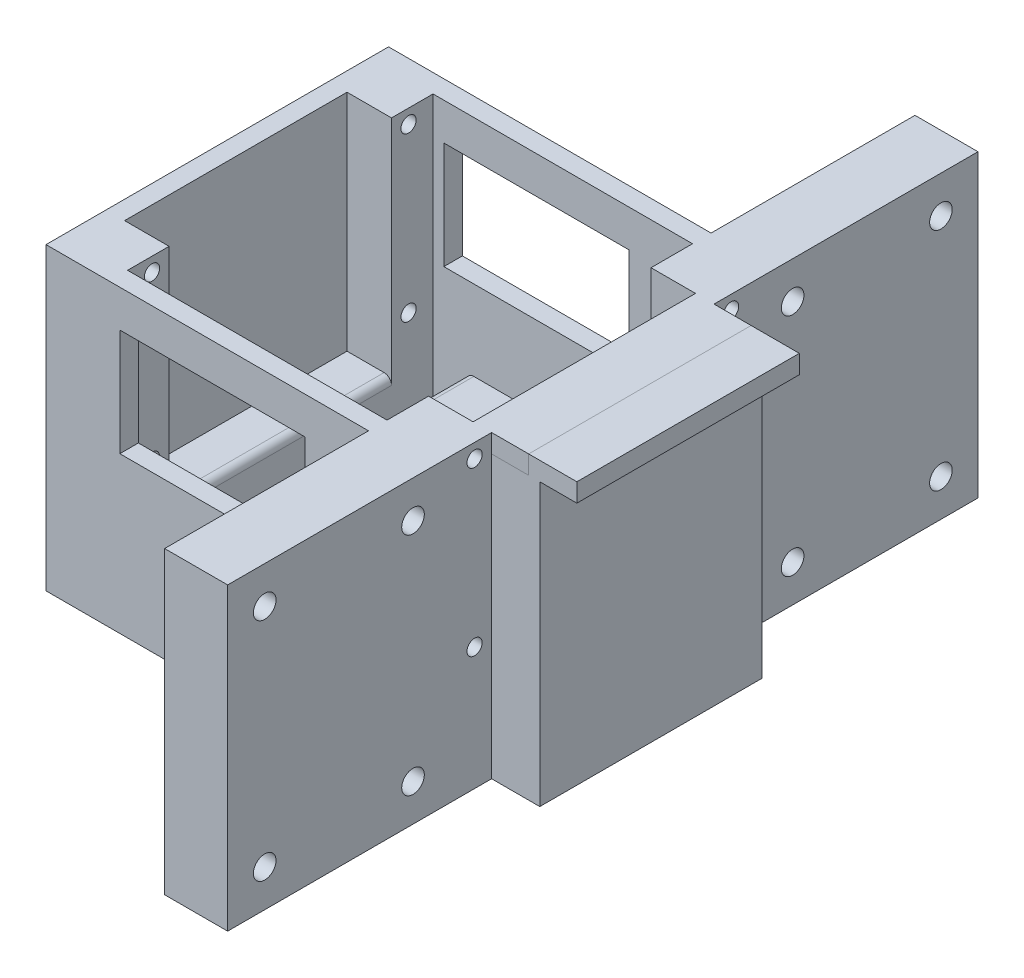
from build123d import *

# Parameters (mm, degrees)
BOSS_EXTRUDE1_DEPTH  = 30
SKETCH2_W            = 5.6
SKETCH2_H            = 40.443252471
SKETCH2_R            = 1.025
BOSS_EXTRUDE2_DEPTH  = 8.5
SKETCH4_W            = 25
SKETCH4_H            = 10.193252471
BOSS_EXTRUDE3_DEPTH  = 5.6
SKETCH5_W            = 25
SKETCH5_H            = 10.193252471
BOSS_EXTRUDE4_DEPTH  = 5.6
FILLET2_R            = 1
BOSS_EXTRUDE5_START  = -8.5
SKETCH6_W            = 5.6
SKETCH6_H            = 40.443252471
SKETCH6_R            = 1.025
BOSS_EXTRUDE5_DEPTH  = 8.5
FILLET3_R            = 1
SKETCH8_R            = 2.1
CUT_EXTRUDE1_DEPTH   = 8.5
SKETCH9_W            = 8.5
SKETCH9_H            = 30
BOSS_EXTRUDE6_DEPTH  = 40.443252471
SKETCH10_R           = 1.525
CUT_EXTRUDE2_DEPTH   = 191.623742611
SKETCH11_W           = 5
SKETCH11_H           = 30
BOSS_EXTRUDE7_DEPTH  = 2.5
SKETCH12_W           = 30
SKETCH12_H           = 37.943252471
BOSS_EXTRUDE8_DEPTH  = 5
SKETCH13_W           = 30
SKETCH13_H           = 40.443252471
BOSS_EXTRUDE9_DEPTH  = 1.5
SKETCH15_W           = 30
SKETCH15_H           = 2.5
BOSS_EXTRUDE10_DEPTH = 5
SKETCH17_W           = 2.5
SKETCH17_H           = 40.443252471
BOSS_EXTRUDE11_DEPTH = 43.500000004
SKETCH18_W           = 25
SKETCH18_H           = 14.443252471
CUT_EXTRUDE5_DEPTH   = 60
SKETCH19_W           = 43.500000004
SKETCH19_H           = 46.2
BOSS_EXTRUDE12_DEPTH = 4.593252471
SKETCH22_R           = 2.05
BOSS_EXTRUDE15_DEPTH = 9


with BuildPart() as part:
    # Sketch1 → Boss-Extrude1 (new body)
    with BuildSketch(Plane.XY):
        Polygon((-492.563683395, 133.170690652), (-492.563683395, 173.613943123), (-495.063683395, 173.613943123), (-495.063683395, 143.363943123), (-501.063683395, 143.363943123), (-501.063683395, 137.763943123), (-506.563683395, 137.763943123), (-506.563683395, 143.363943123), (-519.063683395, 143.363943123), (-531.563683395, 143.363943123), (-531.563683395, 137.763943123), (-536.063683395, 137.763943123), (-536.063683395, 143.363943123), (-542.063683399, 143.363943123), (-542.063683399, 173.613943123), (-544.563683399, 173.613943123), (-544.563683399, 133.170690652), align=None)
    extrude(amount=BOSS_EXTRUDE1_DEPTH)

    # Sketch2 → Boss-Extrude2 (add)
    # profile 1 of 2: a face of its own
    with BuildSketch(Plane.ZY.offset(544.563683399)):
        with Locations((-2.8, 153.392316888)):
            Rectangle(SKETCH2_W, SKETCH2_H)
        with Locations((-2.3, 171.713943123)):
            Circle(SKETCH2_R, mode=Mode.SUBTRACT)
        with Locations((-2.3, 149.713943123)):
            Circle(SKETCH2_R, mode=Mode.SUBTRACT)
    # profile 2 of 2: a face of its own
    with BuildSketch(Plane.ZY.offset(544.563683399)):
        with Locations((32.8, 153.392316888)):
            Rectangle(SKETCH2_W, SKETCH2_H)
        with Locations((32.3, 149.713943123)):
            Circle(SKETCH2_R, mode=Mode.SUBTRACT)
        with Locations((32.3, 171.713943123)):
            Circle(SKETCH2_R, mode=Mode.SUBTRACT)
    extrude(amount=-BOSS_EXTRUDE2_DEPTH)

    # Sketch4 → Boss-Extrude3 (add)
    with BuildSketch(Plane(origin=(0, 0, 0), x_dir=(-1, 0, 0), z_dir=(0, 0, -1))):
        with Locations((519.063683395, 138.267316888)):
            Rectangle(SKETCH4_W, SKETCH4_H)
    extrude(amount=BOSS_EXTRUDE3_DEPTH)

    # Sketch5 → Boss-Extrude4 (add)
    with BuildSketch(Plane.XY.offset(30)):
        with Locations((-519.063683395, 138.267316888)):
            Rectangle(SKETCH5_W, SKETCH5_H)
    extrude(amount=BOSS_EXTRUDE4_DEPTH)

    # Fillet2
    fillet2_edges = [part.edges().sort_by_distance(p)[0] for p in [
        (-531.563683395, 143.363943123, 15),
        (-506.563683395, 143.363943123, 15),
    ]]
    fillet(fillet2_edges, radius=FILLET2_R)

    # Sketch6 → Boss-Extrude5 (add)
    # profile 1 of 2: a face of its own
    with BuildSketch(Plane(origin=(-492.563683395, 0, 0), x_dir=(0, 0, -1), z_dir=(1, 0, 0)).offset(BOSS_EXTRUDE5_START)):
        with Locations((-32.8, 153.392316888)):
            Rectangle(SKETCH6_W, SKETCH6_H)
        with Locations(Location((-32.3, 171.713943123, 0), (0, 0, 180))):
            Circle(SKETCH6_R, mode=Mode.SUBTRACT)
        with Locations(Location((-32.3, 149.713943123, 0), (0, 0, 180))):
            Circle(SKETCH6_R, mode=Mode.SUBTRACT)
    # profile 2 of 2: a face of its own
    with BuildSketch(Plane(origin=(-492.563683395, 0, 0), x_dir=(0, 0, -1), z_dir=(1, 0, 0)).offset(BOSS_EXTRUDE5_START)):
        with Locations((2.8, 153.392316888)):
            Rectangle(SKETCH6_W, SKETCH6_H)
        with Locations(Location((2.3, 171.713943123, 0), (0, 0, 180))):
            Circle(SKETCH6_R, mode=Mode.SUBTRACT)
        with Locations(Location((2.3, 149.713943123, 0), (0, 0, 180))):
            Circle(SKETCH6_R, mode=Mode.SUBTRACT)
    extrude(amount=BOSS_EXTRUDE5_DEPTH)

    # Fillet3
    fillet3_edges = [part.edges().sort_by_distance(p)[0] for p in [
        (-536.063683395, 143.363943123, 15),
        (-501.063683395, 143.363943123, 15),
    ]]
    fillet(fillet3_edges, radius=FILLET3_R)

    # Sketch8 → Cut-Extrude1 (cut)
    with BuildSketch(Plane(origin=(-492.563683395, 0, 0), x_dir=(0, 0, -1), z_dir=(1, 0, 0))):
        with Locations((-15, 153.392316887)):
            Circle(SKETCH8_R)
    extrude(amount=-CUT_EXTRUDE1_DEPTH, mode=Mode.SUBTRACT)

    # Sketch9 → Boss-Extrude6 (add)
    with BuildSketch(Plane(origin=(0, 173.613943123, 0), x_dir=(1, 0, 0), z_dir=(0, 1, 0))):
        with Locations((-496.813683395, 20.6)):
            Rectangle(SKETCH9_W, SKETCH9_H)
        with Locations((-496.813683395, -50.6)):
            Rectangle(SKETCH9_W, SKETCH9_H)
    extrude(amount=-BOSS_EXTRUDE6_DEPTH)

    # Sketch10 → Cut-Extrude2 (cut, through all)
    with BuildSketch(Plane.ZY.offset(501.063683395)):
        with Locations((40.6, 168.613943123)):
            Circle(SKETCH10_R)
        with Locations((60.6, 168.613943123)):
            Circle(SKETCH10_R)
        with Locations((60.6, 138.170690652)):
            Circle(SKETCH10_R)
        with Locations((40.6, 138.170690652)):
            Circle(SKETCH10_R)
        with Locations(Location((-30.6, 168.613943123, 0), (0, 0, 180))):
            Circle(SKETCH10_R)
        with Locations(Location((-30.6, 138.170690652, 0), (0, 0, 180))):
            Circle(SKETCH10_R)
        with Locations(Location((-10.6, 138.170690652, 0), (0, 0, 180))):
            Circle(SKETCH10_R)
        with Locations(Location((-10.6, 168.613943123, 0), (0, 0, 180))):
            Circle(SKETCH10_R)
    extrude(amount=-CUT_EXTRUDE2_DEPTH, mode=Mode.SUBTRACT)

    # Sketch11 → Boss-Extrude7 (add)
    with BuildSketch(Plane(origin=(0, 173.613943123, 0), x_dir=(1, 0, 0), z_dir=(0, 1, 0))):
        with Locations((-490.063683395, -15)):
            Rectangle(SKETCH11_W, SKETCH11_H)
    extrude(amount=-BOSS_EXTRUDE7_DEPTH)

    # Sketch17 → Boss-Extrude11 (add)
    with BuildSketch(Plane.ZY.offset(501.063683395)):
        with Locations((36.85, 153.392316888)):
            Rectangle(SKETCH17_W, SKETCH17_H)
        with Locations((-6.85, 153.392316888)):
            Rectangle(SKETCH17_W, SKETCH17_H)
    extrude(amount=BOSS_EXTRUDE11_DEPTH)

    # Sketch18 → Cut-Extrude5 (cut)
    with BuildSketch(Plane.XY.offset(38.1)):
        with Locations((-522.105650898, 161.392316888)):
            Rectangle(SKETCH18_W, SKETCH18_H)
    extrude(amount=-CUT_EXTRUDE5_DEPTH, mode=Mode.SUBTRACT)

    # Sketch19 → Boss-Extrude12 (add)
    with BuildSketch(Plane.XZ.offset(-133.170690652)):
        with Locations((-522.813683397, 15)):
            Rectangle(SKETCH19_W, SKETCH19_H)
    extrude(amount=-BOSS_EXTRUDE12_DEPTH)


with BuildPart() as body_2:
    # Sketch12 → Boss-Extrude8 (new body)
    with BuildSketch(Plane(origin=(-492.563683395, 0, 0), x_dir=(0, 0, -1), z_dir=(1, 0, 0))):
        with Locations((-15, 152.142316888)):
            Rectangle(SKETCH12_W, SKETCH12_H)
    extrude(amount=BOSS_EXTRUDE8_DEPTH)

    # Sketch13 → Boss-Extrude9 (add)
    with BuildSketch(Plane(origin=(-487.563683395, 0, 0), x_dir=(0, 0, -1), z_dir=(1, 0, 0))):
        with Locations((-15, 153.392316888)):
            Rectangle(SKETCH13_W, SKETCH13_H)
    extrude(amount=BOSS_EXTRUDE9_DEPTH)

    # Sketch15 → Boss-Extrude10 (add)
    with BuildSketch(Plane(origin=(-486.063683395, 0, 0), x_dir=(0, 0, -1), z_dir=(1, 0, 0))):
        with Locations((-15, 172.363943123)):
            Rectangle(SKETCH15_W, SKETCH15_H)
    extrude(amount=BOSS_EXTRUDE10_DEPTH)

    # Sketch22 → Boss-Extrude15 (add)
    with BuildSketch(Plane(origin=(-486.063683395, 0, 0), x_dir=(0, 0, -1), z_dir=(1, 0, 0))):
        with Locations(Location((-15, 153.392316887, 0), (0, 0, 90))):
            Circle(SKETCH22_R)
    extrude(amount=-BOSS_EXTRUDE15_DEPTH)


solid = Compound([part.part, body_2.part])
